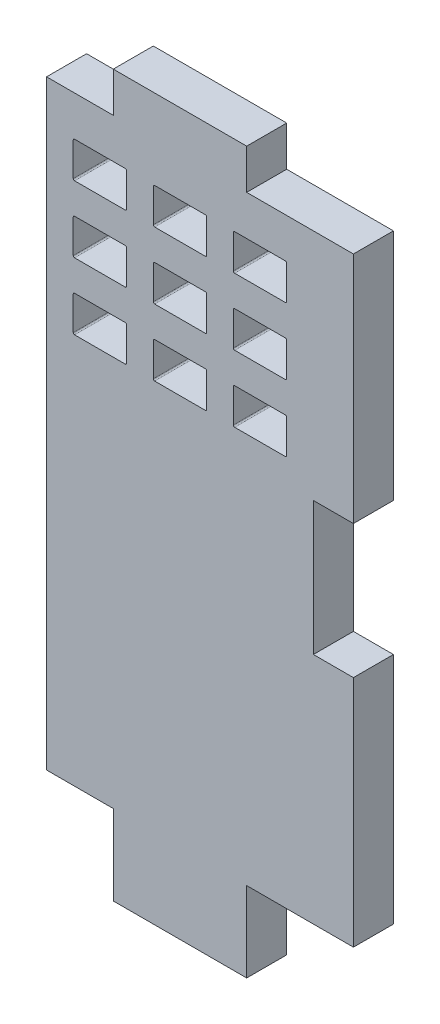
from build123d import *

# Parameters (mm, degrees)
BOSS_EXTRUDE1_DEPTH = 3
CUT_EXTRUDE1_DEPTH  = 54.310411741


with BuildPart() as part:
    # Sketch1 → Boss-Extrude1 (new body)
    with BuildSketch(Plane.XY):
        Polygon((0, 0), (0, 45), (5, 45), (5, 48), (15, 48), (15, 45), (23, 45), (23, 27.5), (20, 27.5), (20, 17.5), (23, 17.5), (23, 0), (15, 0), (15, -6), (5, -6), (5, 0), align=None)
    extrude(amount=BOSS_EXTRUDE1_DEPTH)

    # Sketch2 → Cut-Extrude1 (cut, through all)
    with BuildSketch(Plane.XY.offset(3)):
        with BuildLine():
            Line((2.1, 42), (5.9, 42))
            ThreePointArc((5.9, 42), (5.970710678, 41.970710678), (6, 41.9))
            Line((6, 41.9), (6, 39.4))
            ThreePointArc((6, 39.4), (5.970710678, 39.329289322), (5.9, 39.3))
            Line((5.9, 39.3), (2.1, 39.3))
            ThreePointArc((2.1, 39.3), (2.029289322, 39.329289322), (2, 39.4))
            Line((2, 39.4), (2, 41.9))
            ThreePointArc((2, 41.9), (2.029289322, 41.970710678), (2.1, 42))
        make_face()
        with BuildLine():
            Line((8.1, 42), (11.9, 42))
            ThreePointArc((11.9, 42), (11.970710678, 41.970710678), (12, 41.9))
            Line((12, 41.9), (12, 39.4))
            ThreePointArc((12, 39.4), (11.970710678, 39.329289322), (11.9, 39.3))
            Line((11.9, 39.3), (8.1, 39.3))
            ThreePointArc((8.1, 39.3), (8.029289322, 39.329289322), (8, 39.4))
            Line((8, 39.4), (8, 41.9))
            ThreePointArc((8, 41.9), (8.029289322, 41.970710678), (8.1, 42))
        make_face()
        with BuildLine():
            Line((14.1, 42), (17.9, 42))
            ThreePointArc((17.9, 42), (17.970710678, 41.970710678), (18, 41.9))
            Line((18, 41.9), (18, 39.4))
            ThreePointArc((18, 39.4), (17.970710678, 39.329289322), (17.9, 39.3))
            Line((17.9, 39.3), (14.1, 39.3))
            ThreePointArc((14.1, 39.3), (14.029289322, 39.329289322), (14, 39.4))
            Line((14, 39.4), (14, 41.9))
            ThreePointArc((14, 41.9), (14.029289322, 41.970710678), (14.1, 42))
        make_face()
        with BuildLine():
            Line((8.1, 37), (11.9, 37))
            ThreePointArc((11.9, 37), (11.970710678, 36.970710678), (12, 36.9))
            Line((12, 36.9), (12, 34.4))
            ThreePointArc((12, 34.4), (11.970710678, 34.329289322), (11.9, 34.3))
            Line((11.9, 34.3), (8.1, 34.3))
            ThreePointArc((8.1, 34.3), (8.029289322, 34.329289322), (8, 34.4))
            Line((8, 34.4), (8, 36.9))
            ThreePointArc((8, 36.9), (8.029289322, 36.970710678), (8.1, 37))
        make_face()
        with BuildLine():
            Line((14.1, 37), (17.9, 37))
            ThreePointArc((17.9, 37), (17.970710678, 36.970710678), (18, 36.9))
            Line((18, 36.9), (18, 34.4))
            ThreePointArc((18, 34.4), (17.970710678, 34.329289322), (17.9, 34.3))
            Line((17.9, 34.3), (14.1, 34.3))
            ThreePointArc((14.1, 34.3), (14.029289322, 34.329289322), (14, 34.4))
            Line((14, 34.4), (14, 36.9))
            ThreePointArc((14, 36.9), (14.029289322, 36.970710678), (14.1, 37))
        make_face()
        with BuildLine():
            Line((8.1, 32), (11.9, 32))
            ThreePointArc((11.9, 32), (11.970710678, 31.970710678), (12, 31.9))
            Line((12, 31.9), (12, 29.4))
            ThreePointArc((12, 29.4), (11.970710678, 29.329289322), (11.9, 29.3))
            Line((11.9, 29.3), (8.1, 29.3))
            ThreePointArc((8.1, 29.3), (8.029289322, 29.329289322), (8, 29.4))
            Line((8, 29.4), (8, 31.9))
            ThreePointArc((8, 31.9), (8.029289322, 31.970710678), (8.1, 32))
        make_face()
        with BuildLine():
            Line((14.1, 32), (17.9, 32))
            ThreePointArc((17.9, 32), (17.970710678, 31.970710678), (18, 31.9))
            Line((18, 31.9), (18, 29.4))
            ThreePointArc((18, 29.4), (17.970710678, 29.329289322), (17.9, 29.3))
            Line((17.9, 29.3), (14.1, 29.3))
            ThreePointArc((14.1, 29.3), (14.029289322, 29.329289322), (14, 29.4))
            Line((14, 29.4), (14, 31.9))
            ThreePointArc((14, 31.9), (14.029289322, 31.970710678), (14.1, 32))
        make_face()
        with BuildLine():
            Line((2.1, 37), (5.9, 37))
            ThreePointArc((5.9, 37), (5.970710678, 36.970710678), (6, 36.9))
            Line((6, 36.9), (6, 34.4))
            ThreePointArc((6, 34.4), (5.970710678, 34.329289322), (5.9, 34.3))
            Line((5.9, 34.3), (2.1, 34.3))
            ThreePointArc((2.1, 34.3), (2.029289322, 34.329289322), (2, 34.4))
            Line((2, 34.4), (2, 36.9))
            ThreePointArc((2, 36.9), (2.029289322, 36.970710678), (2.1, 37))
        make_face()
        with BuildLine():
            Line((2.1, 32), (5.9, 32))
            ThreePointArc((5.9, 32), (5.970710678, 31.970710678), (6, 31.9))
            Line((6, 31.9), (6, 29.4))
            ThreePointArc((6, 29.4), (5.970710678, 29.329289322), (5.9, 29.3))
            Line((5.9, 29.3), (2.1, 29.3))
            ThreePointArc((2.1, 29.3), (2.029289322, 29.329289322), (2, 29.4))
            Line((2, 29.4), (2, 31.9))
            ThreePointArc((2, 31.9), (2.029289322, 31.970710678), (2.1, 32))
        make_face()
    extrude(amount=-CUT_EXTRUDE1_DEPTH, mode=Mode.SUBTRACT)


solid = part.part
